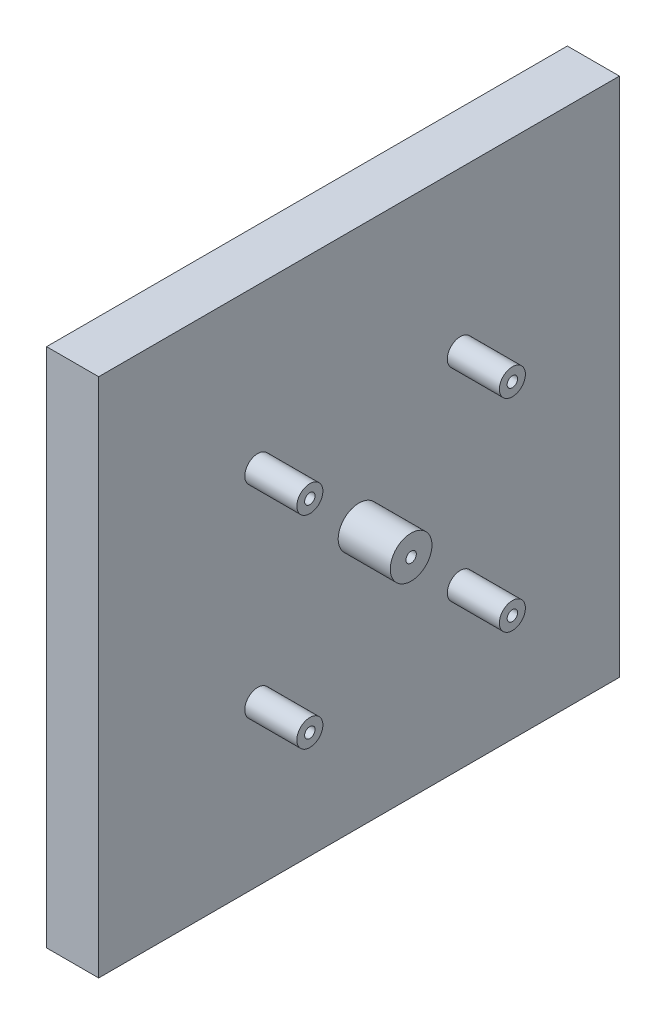
from build123d import *

# Parameters (mm, degrees)
SKETCH1_W           = 100
SKETCH1_H           = 100
SKETCH1_R           = 1
BOSS_EXTRUDE2_DEPTH = 10
SKETCH2_R           = 4
SKETCH2_R_2         = 1
SKETCH2_R_3         = 2.5
BOSS_EXTRUDE3_DEPTH = 10


with BuildPart() as part:
    # Sketch1 → Boss-Extrude2 (new body)
    with BuildSketch(Plane(origin=(0, 0, 0), x_dir=(0, 0, -1), z_dir=(1, 0, 0))):
        Rectangle(SKETCH1_W, SKETCH1_H)
        with Locations((19.445436483, 19.445436483)):
            Circle(SKETCH1_R, mode=Mode.SUBTRACT)
        with Locations((19.445436483, -19.445436483)):
            Circle(SKETCH1_R, mode=Mode.SUBTRACT)
        with Locations((-19.445436483, -19.445436483)):
            Circle(SKETCH1_R, mode=Mode.SUBTRACT)
        with Locations((-19.445436483, 19.445436483)):
            Circle(SKETCH1_R, mode=Mode.SUBTRACT)
        Circle(SKETCH1_R, mode=Mode.SUBTRACT)
    extrude(amount=BOSS_EXTRUDE2_DEPTH)

    # Sketch2 → Boss-Extrude3 (add)
    # profile 1 of 5: a face of its own
    with BuildSketch(Plane(origin=(10, 0, 0), x_dir=(0, 0, -1), z_dir=(1, 0, 0))):
        Circle(SKETCH2_R)
        Circle(SKETCH2_R_2, mode=Mode.SUBTRACT)
    # profile 2 of 5: a face of its own
    with BuildSketch(Plane(origin=(10, 0, 0), x_dir=(0, 0, -1), z_dir=(1, 0, 0))):
        with Locations((19.445436483, 19.445436483)):
            Circle(SKETCH2_R_3)
        with Locations((19.445436483, 19.445436483)):
            Circle(SKETCH2_R_2, mode=Mode.SUBTRACT)
    # profile 3 of 5: a face of its own
    with BuildSketch(Plane(origin=(10, 0, 0), x_dir=(0, 0, -1), z_dir=(1, 0, 0))):
        with Locations((19.445436483, -19.445436483)):
            Circle(SKETCH2_R_3)
        with Locations((19.445436483, -19.445436483)):
            Circle(SKETCH2_R_2, mode=Mode.SUBTRACT)
    # profile 4 of 5: a face of its own
    with BuildSketch(Plane(origin=(10, 0, 0), x_dir=(0, 0, -1), z_dir=(1, 0, 0))):
        with Locations((-19.445436483, -19.445436483)):
            Circle(SKETCH2_R_3)
        with Locations((-19.445436483, -19.445436483)):
            Circle(SKETCH2_R_2, mode=Mode.SUBTRACT)
    # profile 5 of 5: a face of its own
    with BuildSketch(Plane(origin=(10, 0, 0), x_dir=(0, 0, -1), z_dir=(1, 0, 0))):
        with Locations((-19.445436483, 19.445436483)):
            Circle(SKETCH2_R_3)
        with Locations((-19.445436483, 19.445436483)):
            Circle(SKETCH2_R_2, mode=Mode.SUBTRACT)
    extrude(amount=BOSS_EXTRUDE3_DEPTH)


solid = part.part
